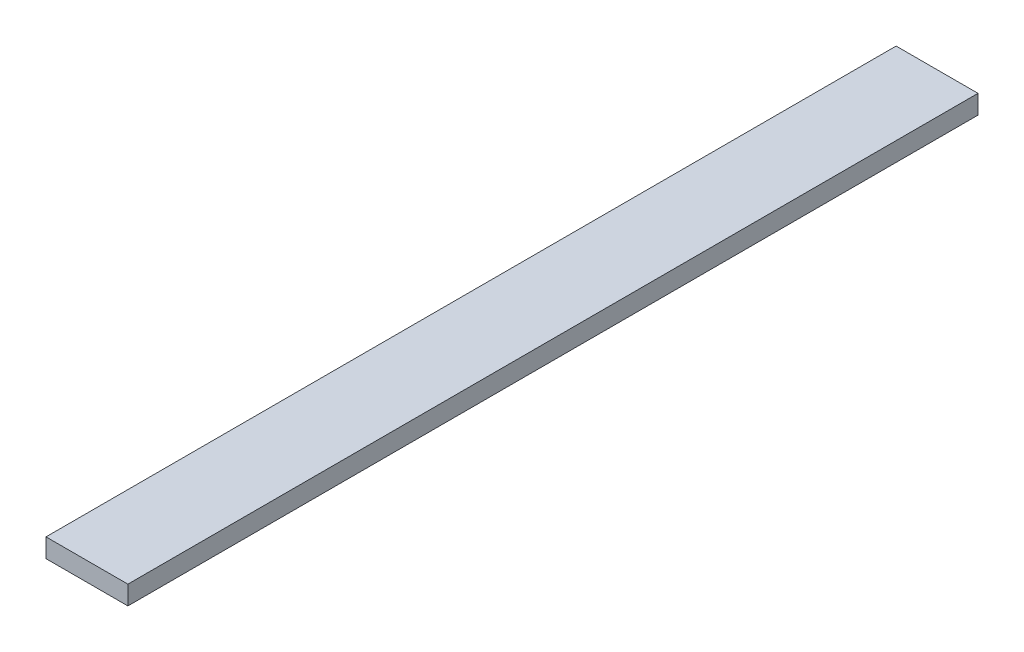
from build123d import *

# Parameters (mm, degrees)
SKETCH1_W           = 41.275
SKETCH1_H           = 9.525
BOSS_EXTRUDE1_DEPTH = 428.498


with BuildPart() as part:
    # Sketch1 → Boss-Extrude1 (new body)
    with BuildSketch(Plane.XY):
        with Locations((20.6375, 4.7625)):
            Rectangle(SKETCH1_W, SKETCH1_H)
    extrude(amount=BOSS_EXTRUDE1_DEPTH)


solid = part.part
